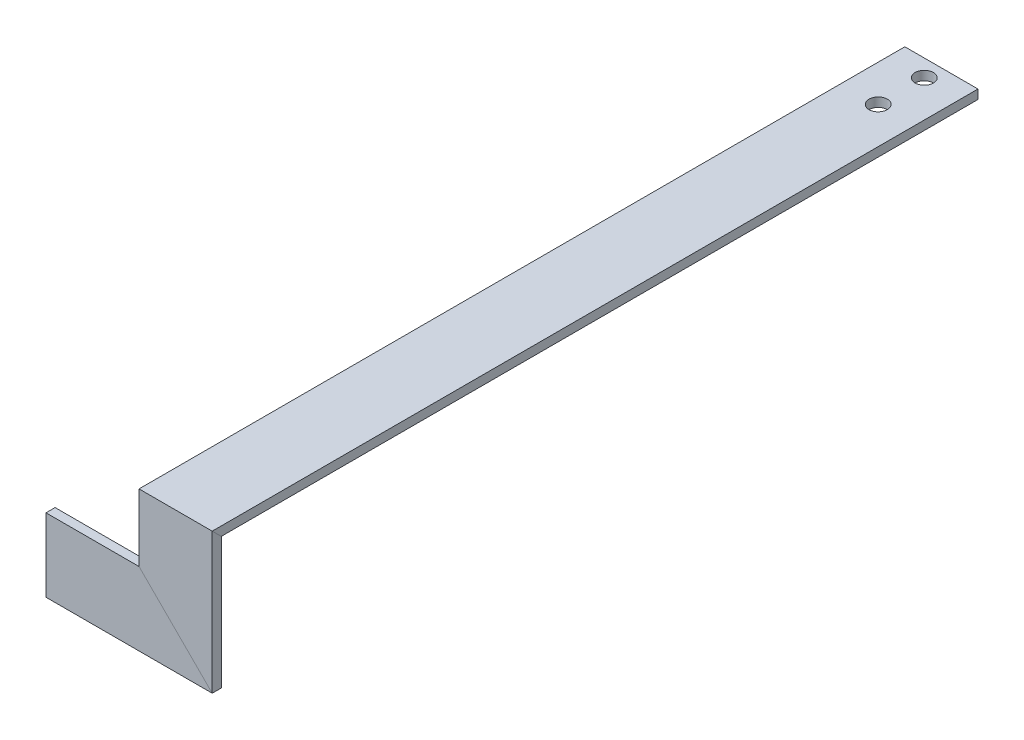
from build123d import *

# Parameters (mm, degrees)
CROQUIS1_W            = 50.8
CROQUIS1_H            = 6.31
CROQUIS2_R            = 6.35
CORTAR_EXTRUIR1_DEPTH = 6.31


with BuildPart() as part:
    # Barrer1: sweep along a curve in space
    with BuildLine() as barrer1_path:
        Line((0, 0, 0), (0, 0, 528.55))
        Line((0, 0, 528.55), (0, -68.92, 528.55))
        Line((0, -68.92, 528.55), (-90, -68.92, 528.55))
    # Croquis1 → Barrer1 (sweep)
    with BuildSketch(Plane.XY):
        Rectangle(CROQUIS1_W, CROQUIS1_H)
    sweep(path=barrer1_path.line, transition=Transition.RIGHT)

    # Croquis2 → Cortar-Extruir1 (cut)
    with BuildSketch(Plane(origin=(0, 3.155, 0), x_dir=(1, 0, 0), z_dir=(0, 1, 0))):
        with Locations(Location((0, -43.892204666, 0), (0, 0, 270))):
            Circle(CROQUIS2_R)
        with Locations(Location((0, -11.892204666, 0), (0, 0, 270))):
            Circle(CROQUIS2_R)
    extrude(amount=-CORTAR_EXTRUIR1_DEPTH, mode=Mode.SUBTRACT)


solid = part.part
